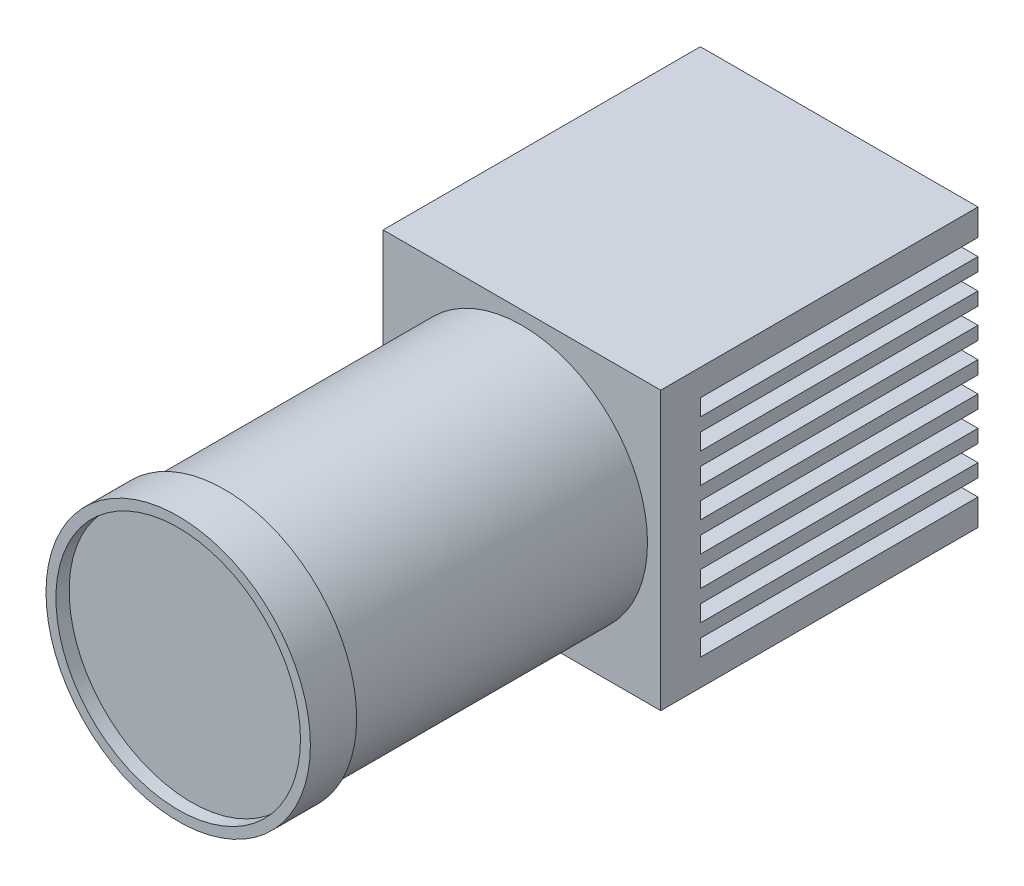
from build123d import *

# Parameters (mm, degrees)
SKETCH2_W           = 42
SKETCH2_H           = 42
BOSS_EXTRUDE1_DEPTH = 48
SKETCH3_R           = 19
BOSS_EXTRUDE2_DEPTH = 50
SKETCH4_R           = 20
SKETCH4_R_2         = 18.5
BOSS_EXTRUDE3_DEPTH = 5
SKETCH5_R           = 20
SKETCH5_R_2         = 18.5
BOSS_EXTRUDE4_DEPTH = 2
SKETCH6_W           = 2.5
SKETCH6_H           = 2.5
CUT_EXTRUDE1_DEPTH  = 42


with BuildPart() as part:
    # Sketch2 → Boss-Extrude1 (new body)
    with BuildSketch(Plane.XY):
        with Locations((21, 21)):
            Rectangle(SKETCH2_W, SKETCH2_H)
    extrude(amount=BOSS_EXTRUDE1_DEPTH)

    # Sketch3 → Boss-Extrude2 (add)
    with BuildSketch(Plane.XY.offset(48)):
        with Locations((21, 21)):
            Circle(SKETCH3_R)
    extrude(amount=BOSS_EXTRUDE2_DEPTH)



with BuildPart() as body_2:
    # Sketch4 → Boss-Extrude3 (new body)
    with BuildSketch(Plane.XY.offset(98)):
        with Locations((21, 21)):
            Circle(SKETCH4_R)
        with Locations((21, 21)):
            Circle(SKETCH4_R_2, mode=Mode.SUBTRACT)
    extrude(amount=-BOSS_EXTRUDE3_DEPTH)


with BuildPart() as part_1:
    add(part.part)

    add(body_2.part)  # Boss-Extrude4 merges body 2
    # Sketch5 → Boss-Extrude4 (add)
    with BuildSketch(Plane.XY.offset(98)):
        with Locations((21, 21)):
            Circle(SKETCH5_R)
        with Locations((21, 21)):
            Circle(SKETCH5_R_2, mode=Mode.SUBTRACT)
    extrude(amount=BOSS_EXTRUDE4_DEPTH)

    # Sketch6 → Cut-Extrude1 (cut)
    with BuildSketch(Plane(origin=(0, 0, 0), x_dir=(-1, 0, 0), z_dir=(0, 0, -1))):
        with Locations((-40.75, 36.75)):
            Rectangle(SKETCH6_W, SKETCH6_H)
        with Locations((-40.75, 5.25)):
            Rectangle(SKETCH6_W, SKETCH6_H)
        with Locations((-40.75, 32.25)):
            Rectangle(SKETCH6_W, SKETCH6_H)
        with Locations((-40.75, 23.25)):
            Rectangle(SKETCH6_W, SKETCH6_H)
        with Locations((-40.75, 18.75)):
            Rectangle(SKETCH6_W, SKETCH6_H)
        with Locations((-40.75, 14.25)):
            Rectangle(SKETCH6_W, SKETCH6_H)
        with Locations((-40.75, 9.75)):
            Rectangle(SKETCH6_W, SKETCH6_H)
        with Locations((-40.75, 27.75)):
            Rectangle(SKETCH6_W, SKETCH6_H)
        with Locations((-1.25, 5.25)):
            Rectangle(SKETCH6_W, SKETCH6_H)
        with Locations((-1.25, 27.75)):
            Rectangle(SKETCH6_W, SKETCH6_H)
        with Locations((-1.25, 9.75)):
            Rectangle(SKETCH6_W, SKETCH6_H)
        with Locations((-1.25, 14.25)):
            Rectangle(SKETCH6_W, SKETCH6_H)
        with Locations((-1.25, 18.75)):
            Rectangle(SKETCH6_W, SKETCH6_H)
        with Locations((-1.25, 23.25)):
            Rectangle(SKETCH6_W, SKETCH6_H)
        with Locations((-1.25, 32.25)):
            Rectangle(SKETCH6_W, SKETCH6_H)
        with Locations((-1.25, 36.75)):
            Rectangle(SKETCH6_W, SKETCH6_H)
    extrude(amount=-CUT_EXTRUDE1_DEPTH, mode=Mode.SUBTRACT)


solid = part_1.part
